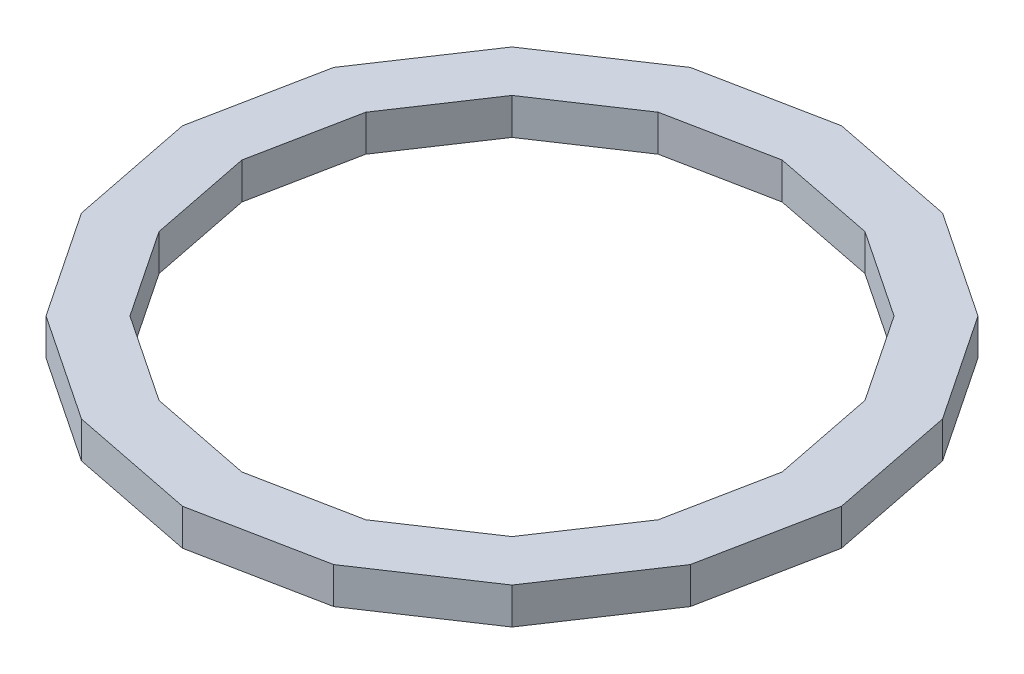
from build123d import *

# Parameters (mm, degrees)
BOSS_EXTRUDE1_DEPTH = 19.05


with BuildPart() as part:
    # Sketch1 → Boss-Extrude1 (new body)
    with BuildSketch(Plane(origin=(0, 0, 0), x_dir=(1, 0, 0), z_dir=(0, 1, 0))):
        Polygon((172.509838787, 0), (159.378309213, 66.016657224), (121.982876828, 121.982876828), (66.016657224, 159.378309213), (0, 172.509838787), (-66.016657224, 159.378309213), (-121.982876828, 121.982876828), (-159.378309213, 66.016657224), (-172.509838787, 0), (-159.378309213, -66.016657224), (-121.982876828, -121.982876828), (-66.016657224, -159.378309213), (0, -172.509838787), (66.016657224, -159.378309213), (121.982876828, -121.982876828), (159.378309213, -66.016657224), align=None)
        Polygon((141.432700285, 0), (130.666777021, 54.123951194), (100.008021453, 100.008021453), (54.123951194, 130.666777021), (0, 141.432700285), (-54.123951194, 130.666777021), (-100.008021453, 100.008021453), (-130.666777021, 54.123951194), (-141.432700285, 0), (-130.666777021, -54.123951194), (-100.008021453, -100.008021453), (-54.123951194, -130.666777021), (0, -141.432700285), (54.123951194, -130.666777021), (100.008021453, -100.008021453), (130.666777021, -54.123951194), align=None, mode=Mode.SUBTRACT)
    extrude(amount=BOSS_EXTRUDE1_DEPTH)


solid = part.part
